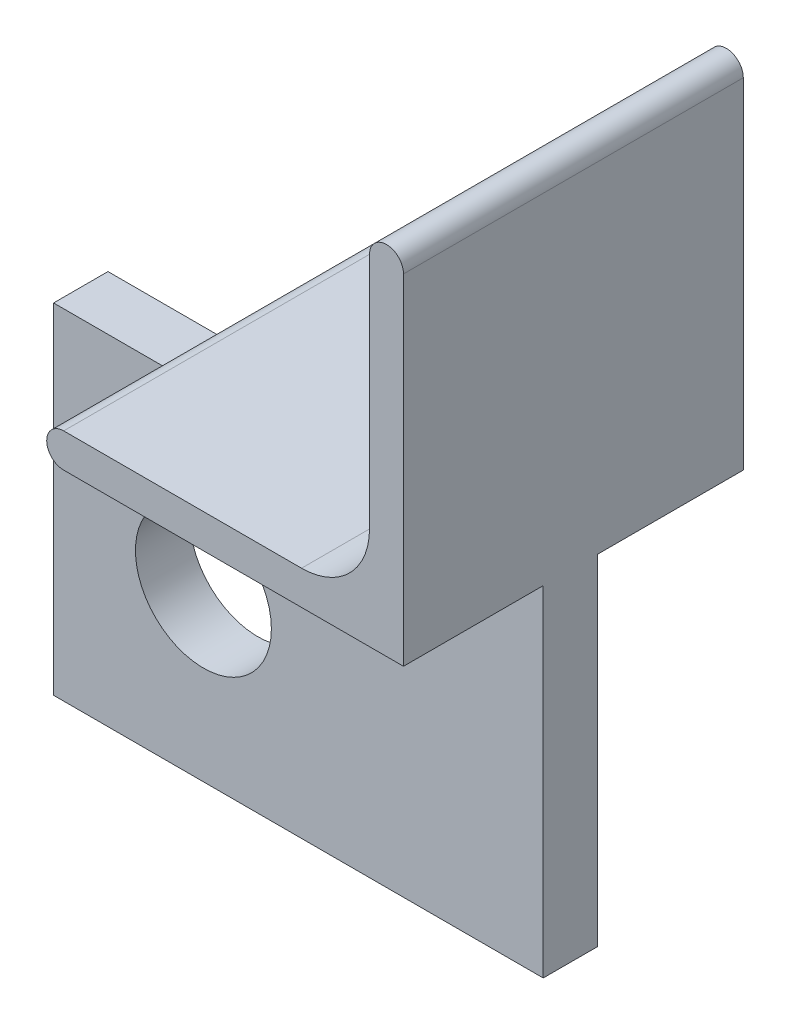
from build123d import *

# Parameters (mm, degrees)
SALIENTE_EXTRUIR1_DEPTH = 25
CROQUIS2_W              = 72.044924806
CROQUIS2_H              = 8
SALIENTE_EXTRUIR2_DEPTH = 50
CROQUIS3_R              = 10
CORTAR_EXTRUIR1_DEPTH   = 50


with BuildPart() as part:
    # Croquis1 → Saliente-Extruir1 (new, symmetric)
    with BuildSketch(Plane.XY):
        with BuildLine():
            Line((0, 0), (50, 0))
            Line((50, 0), (50, 50))
            ThreePointArc((50, 50), (47.5, 52.5), (45, 50))
            Line((45, 50), (45, 15))
            ThreePointArc((45, 15), (42.071067812, 7.928932188), (35, 5))
            Line((35, 5), (0, 5))
            ThreePointArc((0, 5), (-2.5, 2.5), (0, 0))
        make_face()
    extrude(amount=SALIENTE_EXTRUIR1_DEPTH, both=True)

    # Croquis2 → Saliente-Extruir2 (add)
    with BuildSketch(Plane.XZ):
        with Locations((13.977537597, 0.439965546)):
            Rectangle(CROQUIS2_W, CROQUIS2_H)
    extrude(amount=SALIENTE_EXTRUIR2_DEPTH)

    # Croquis3 → Cortar-Extruir1 (cut)
    with BuildSketch(Plane.XY.offset(4.439965546)):
        with Locations((0, -25.510653739)):
            Circle(CROQUIS3_R)
    extrude(amount=-CORTAR_EXTRUIR1_DEPTH, mode=Mode.SUBTRACT)


solid = part.part
